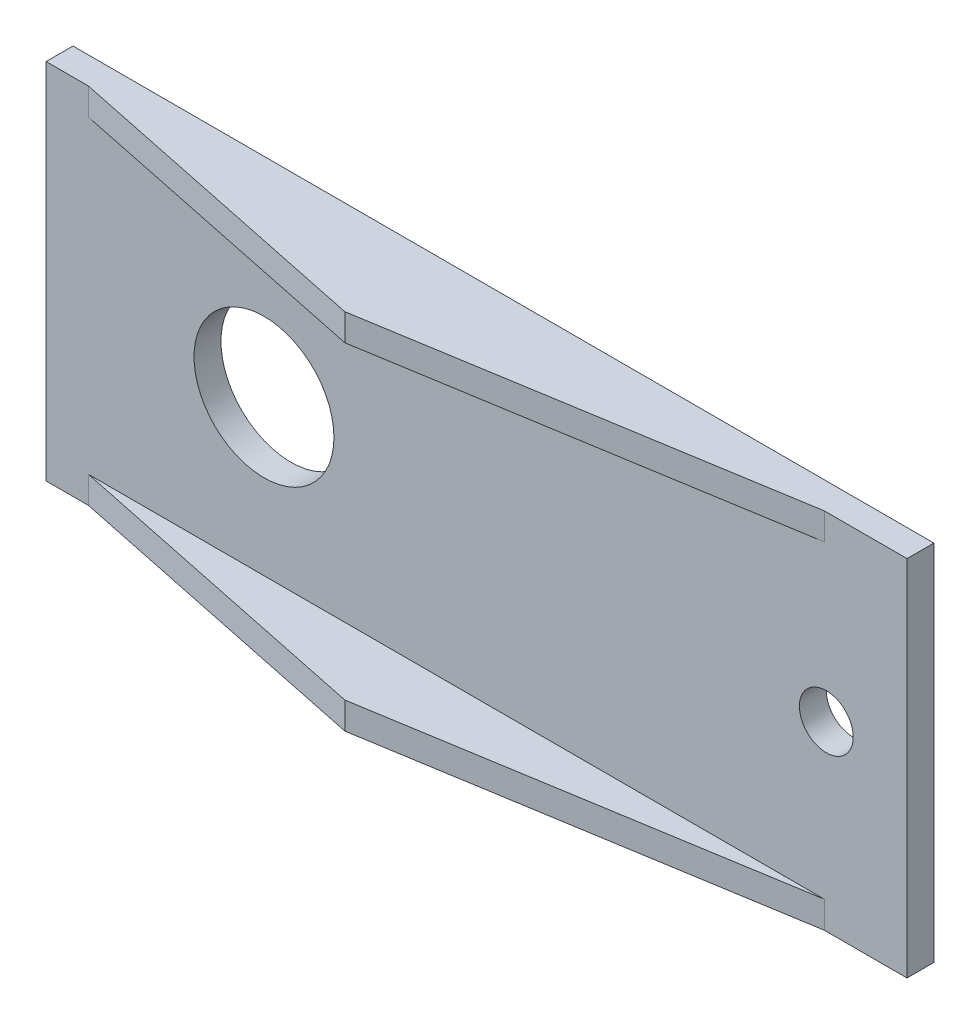
from build123d import *

# Parameters (mm, degrees)
CROQUIS1_W              = 32
CROQUIS1_H              = 13.5
CROQUIS1_R              = 2.6
CROQUIS1_R_2            = 1
SALIENTE_EXTRUIR1_DEPTH = 1
SALIENTE_EXTRUIR2_DEPTH = 1


with BuildPart() as part:
    # Croquis1 → Saliente-Extruir1 (new body)
    with BuildSketch(Plane.XY):
        with Locations((16, -6.75)):
            Rectangle(CROQUIS1_W, CROQUIS1_H)
        with Locations((8.1, -6.75)):
            Circle(CROQUIS1_R, mode=Mode.SUBTRACT)
        with Locations((29, -6.75)):
            Circle(CROQUIS1_R_2, mode=Mode.SUBTRACT)
    extrude(amount=SALIENTE_EXTRUIR1_DEPTH)

    # Croquis2 → Saliente-Extruir2 (add)
    with BuildSketch(Plane(origin=(0, 0, 0), x_dir=(1, 0, 0), z_dir=(0, 1, 0))):
        Polygon((1.571524395, -1), (13.606050016, -3.5), (28.926741078, -1), align=None)
    saliente_extruir2 = extrude(amount=-SALIENTE_EXTRUIR2_DEPTH)

    # Simetría1: Saliente-Extruir2 across plane
    add(saliente_extruir2.mirror(Plane.ZX.offset(-6.75)))


solid = part.part
